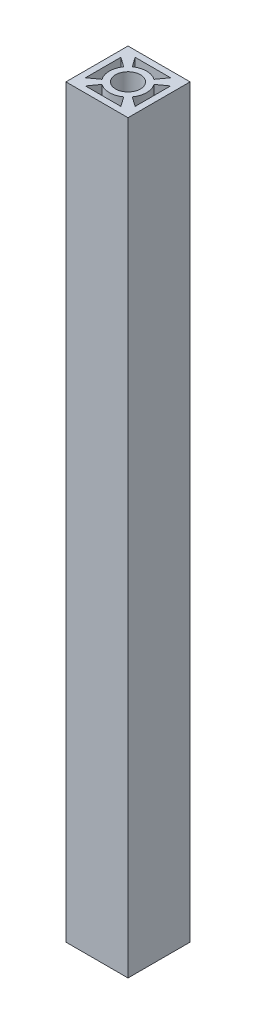
from build123d import *

# Parameters (mm, degrees)
SKETCH1_W           = 100
SKETCH1_H           = 1200
BOSS_EXTRUDE1_DEPTH = 100
SKETCH3_R           = 20
CUT_EXTRUDE1_DEPTH  = 1206.197079319


with BuildPart() as part:
    # Sketch1 → Boss-Extrude1 (new body)
    with BuildSketch(Plane.XY):
        Rectangle(SKETCH1_W, SKETCH1_H)
    extrude(amount=BOSS_EXTRUDE1_DEPTH)

    # Sketch3 → Cut-Extrude1 (cut, through all)
    with BuildSketch(Plane(origin=(0, 600, 0), x_dir=(1, 0, 0), z_dir=(0, 1, 0))):
        with Locations(Location((0, -50, 0), (0, 0, 270))):
            Circle(SKETCH3_R)
        with BuildLine():
            Line((-24.411222461, -67.438240105), (-40, -78.57413656))
            Line((-40, -78.57413656), (-40, -21.42586344))
            Line((-40, -21.42586344), (-24.411222461, -32.561759895))
            ThreePointArc((-24.411222461, -32.561759895), (-30, -50), (-24.411222461, -67.438240105))
        make_face()
        with BuildLine():
            Line((-17.438240105, -25.588777539), (-28.57413656, -10))
            Line((-28.57413656, -10), (28.57413656, -10))
            Line((28.57413656, -10), (17.438240105, -25.588777539))
            ThreePointArc((17.438240105, -25.588777539), (0, -20), (-17.438240105, -25.588777539))
        make_face()
        with BuildLine():
            Line((24.411222461, -32.561759895), (40, -21.42586344))
            Line((40, -21.42586344), (40, -78.57413656))
            Line((40, -78.57413656), (24.411222461, -67.438240105))
            ThreePointArc((24.411222461, -67.438240105), (30, -50), (24.411222461, -32.561759895))
        make_face()
        with BuildLine():
            Line((17.438240105, -74.411222461), (28.57413656, -90))
            Line((28.57413656, -90), (-28.57413656, -90))
            Line((-28.57413656, -90), (-17.438240105, -74.411222461))
            ThreePointArc((-17.438240105, -74.411222461), (0, -80), (17.438240105, -74.411222461))
        make_face()
    extrude(amount=-CUT_EXTRUDE1_DEPTH, mode=Mode.SUBTRACT)


solid = part.part
